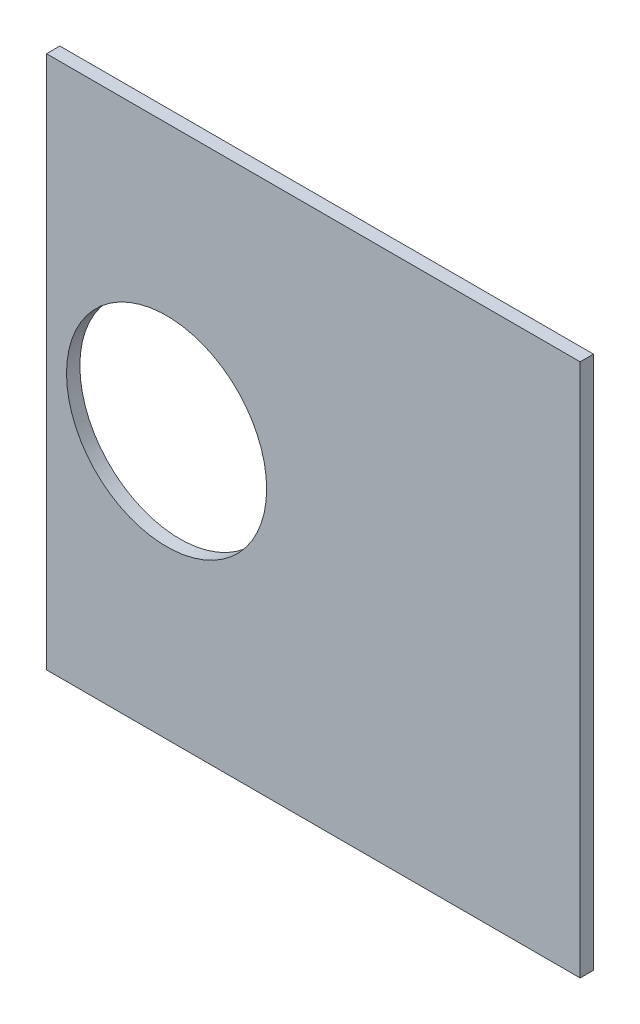
from build123d import *

# Parameters (mm, degrees)
SKETCH_1_W          = 400
SKETCH_1_H          = 400
EXTRUDE_1_DEPTH     = 10
SKETCH_2_R          = 75
CUT_EXTRUDE_1_DEPTH = 284.019433962


with BuildPart() as part:
    # 草图1 → 凸台-拉伸1 (new body)
    with BuildSketch(Plane.XY):
        Rectangle(SKETCH_1_W, SKETCH_1_H)
    extrude(amount=EXTRUDE_1_DEPTH)

    # 草图2 → 切除-拉伸1 (cut, through all)
    with BuildSketch(Plane.XY.offset(10)):
        with Locations((-110, 0)):
            Circle(SKETCH_2_R)
    extrude(amount=-CUT_EXTRUDE_1_DEPTH, mode=Mode.SUBTRACT)


solid = part.part
